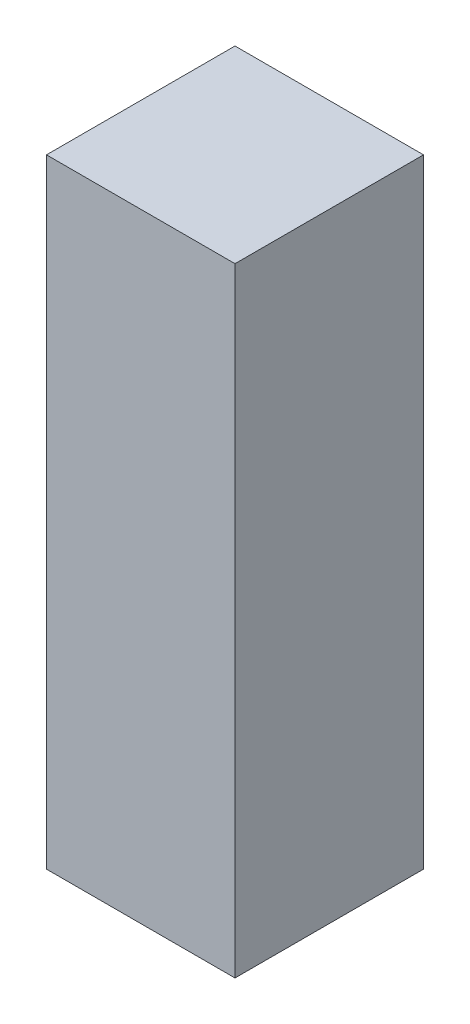
from build123d import *

# Parameters (mm, degrees)
SKETCH1_W           = 71
SKETCH1_H           = 71
BOSS_EXTRUDE1_DEPTH = 233


with BuildPart() as part:
    # Sketch1 → Boss-Extrude1 (new body)
    with BuildSketch(Plane(origin=(0, 0, 0), x_dir=(1, 0, 0), z_dir=(0, 1, 0))):
        with Locations((35.5, 35.5)):
            Rectangle(SKETCH1_W, SKETCH1_H)
    extrude(amount=BOSS_EXTRUDE1_DEPTH)


solid = part.part
